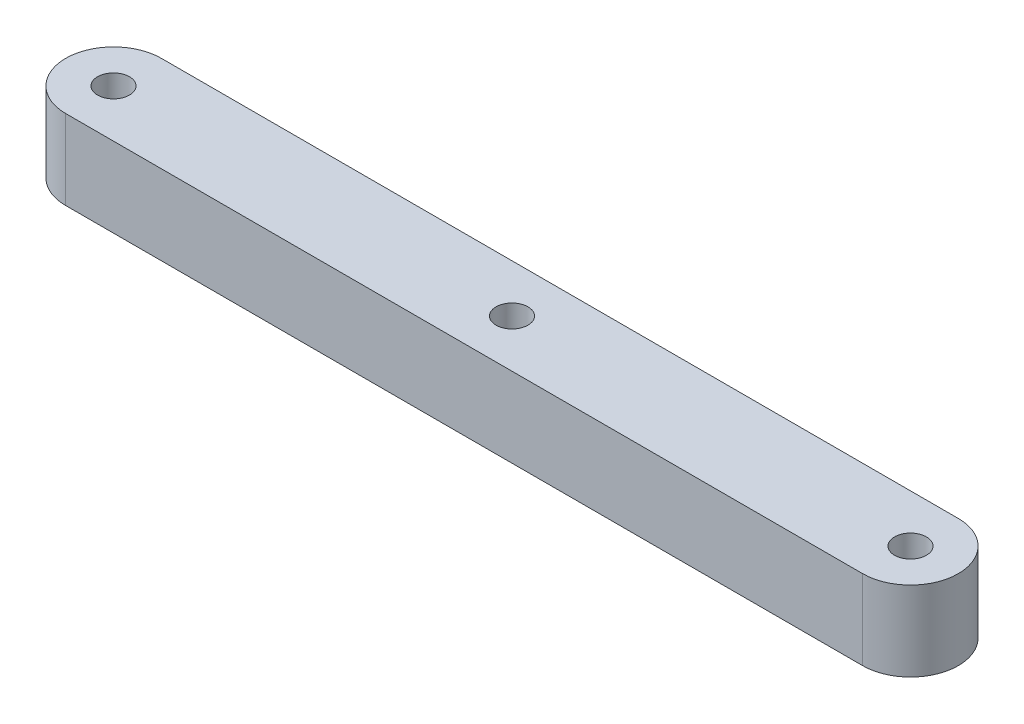
from build123d import *

# Parameters (mm, degrees)
BOSS_EXTRUDE1_DEPTH = 12.7
SKETCH4_R           = 2.54
CUT_EXTRUDE3_DEPTH  = 73.645776202


with BuildPart() as part:
    # Sketch3 → Boss-Extrude1 (new body)
    with BuildSketch(Plane(origin=(0, 0, 0), x_dir=(1, 0, 0), z_dir=(0, 1, 0))):
        with BuildLine():
            Line((-63.5, 7.62), (63.5, 7.62))
            ThreePointArc((63.5, 7.62), (71.12, 0), (63.5, -7.62))
            Line((63.5, -7.62), (-63.5, -7.62))
            ThreePointArc((-63.5, -7.62), (-71.12, 0), (-63.5, 7.62))
        make_face()
    extrude(amount=BOSS_EXTRUDE1_DEPTH)

    # Sketch4 → Cut-Extrude3 (cut, through all)
    with BuildSketch(Plane(origin=(0, 12.7, 0), x_dir=(1, 0, 0), z_dir=(0, 1, 0))):
        with Locations(Location((-63.5, 0, 0), (0, 0, 270))):
            Circle(SKETCH4_R)
        with Locations(Location((63.5, 0, 0), (0, 0, 90))):
            Circle(SKETCH4_R)
        with Locations(Location((0, 0, 0), (0, 0, 270))):
            Circle(SKETCH4_R)
    extrude(amount=-CUT_EXTRUDE3_DEPTH, mode=Mode.SUBTRACT)


solid = part.part
